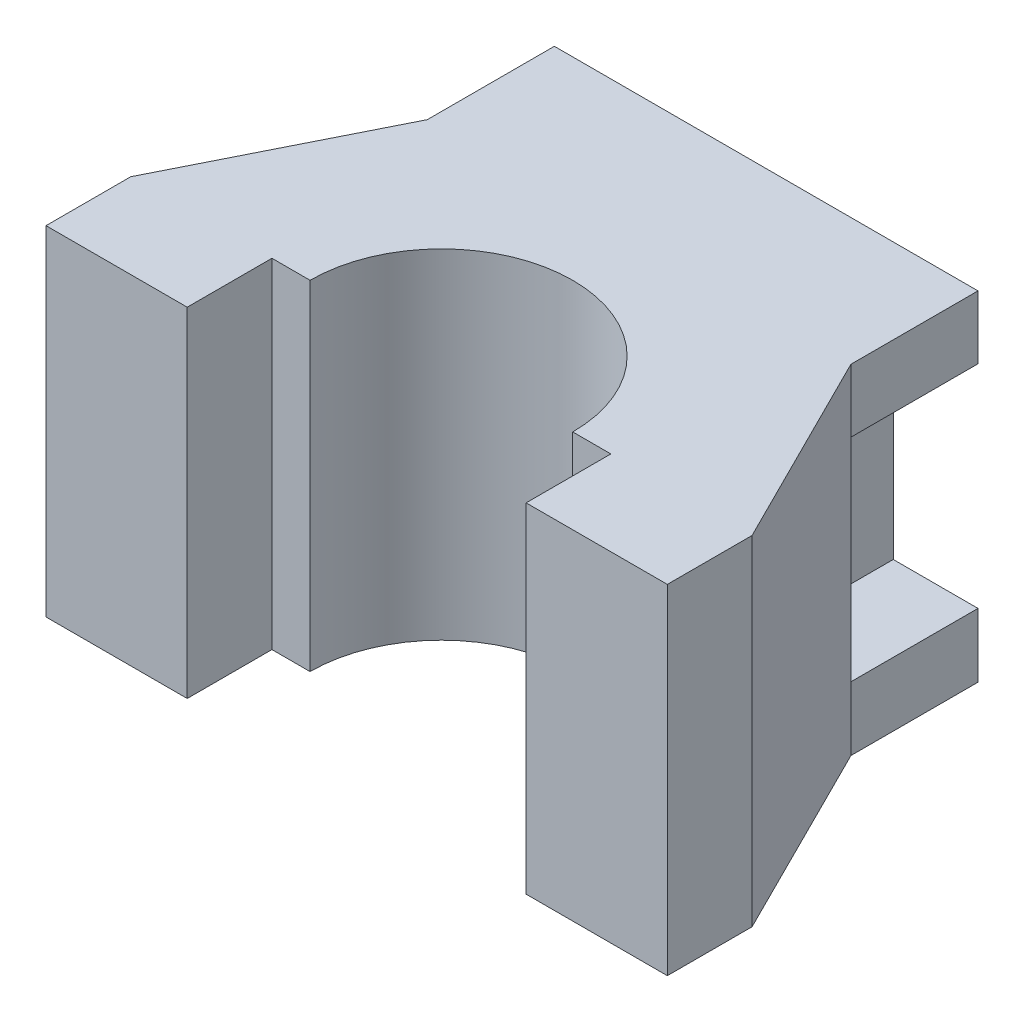
from build123d import *

# Parameters (mm, degrees)
BOSS_EXTRUDE1_DEPTH = 48
SKETCH2_W           = 12
SKETCH2_H           = 30
CUT_EXTRUDE1_DEPTH  = 18


with BuildPart() as part:
    # Sketch1 → Boss-Extrude1 (new body)
    with BuildSketch(Plane(origin=(0, 0, 0), x_dir=(1, 0, 0), z_dir=(0, 1, 0))):
        with BuildLine():
            Line((-44, 0), (-24, 0))
            Line((-24, 0), (-24, 12))
            Line((-24, 12), (-18.601840861, 12))
            ThreePointArc((-18.601840861, 12), (0, 30.601840861), (18.601840861, 12))
            Line((18.601840861, 12), (24, 12))
            Line((24, 12), (24, 0))
            Line((24, 0), (44, 0))
            Line((44, 0), (44, 12))
            Line((44, 12), (30, 40))
            Line((30, 40), (30, 58))
            Line((30, 58), (-30, 58))
            Line((-30, 58), (-30, 40))
            Line((-30, 40), (-44, 12))
            Line((-44, 12), (-44, 0))
        make_face()
    extrude(amount=-BOSS_EXTRUDE1_DEPTH)

    # Sketch2 → Cut-Extrude1 (cut)
    with BuildSketch(Plane(origin=(0, 0, -58), x_dir=(-1, 0, 0), z_dir=(0, 0, -1))):
        with Locations((-24, -23.945628859)):
            Rectangle(SKETCH2_W, SKETCH2_H)
    cut_extrude1 = extrude(amount=-CUT_EXTRUDE1_DEPTH, mode=Mode.SUBTRACT)

    # Mirror1: Cut-Extrude1 across plane
    add(cut_extrude1.mirror(Plane(origin=(0, 0, 0), x_dir=(0, 0, 1), z_dir=(1, 0, 0))), mode=Mode.SUBTRACT)


solid = part.part
